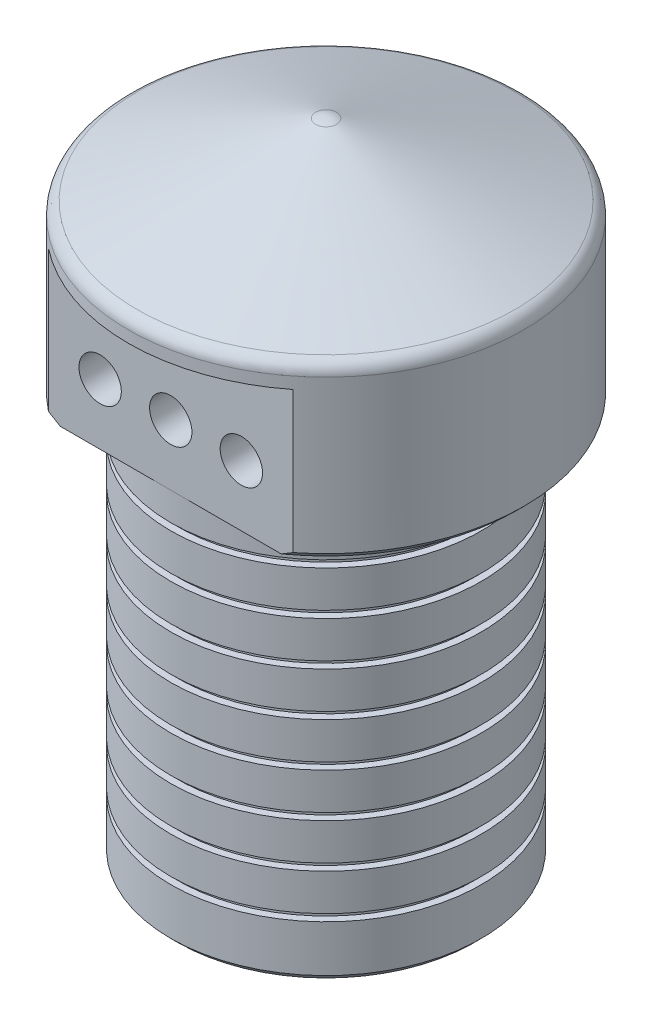
from build123d import *

# Parameters (mm, degrees)
SKETCH_1_R               = 11
EXTRUDE_1_DEPTH          = 28
SKETCH_2_R               = 14
EXTRUDE_2_DEPTH          = 12
FILLET_1_R               = 1
CHAMFER_1_SIZE           = 0.5
SKETCH_4_W               = 0.5
SKETCH_4_H               = 0.5
SKETCH_5_R               = 9
CUT_EXTRUDE_1_DEPTH      = 29
SKETCH_6_R               = 3
CUT_EXTRUDE_2_DEPTH      = 5
CUT_EXTRUDE_3_DEPTH      = 10.5
CUT_EXTRUDE_3_DEPTH_BACK = 2.2
CUT_EXTRUDE_3_START      = 28
SKETCH_7_W               = 42.252524986
SKETCH_7_H               = 12.607828389
SKETCH_8_R               = 1.5
CUT_EXTRUDE_4_DEPTH      = 10.5
SKETCH_8_3_R             = 1.5
CUT_EXTRUDE_5_DEPTH      = 54.724603976
CUT_EXTRUDE_START        = -7
SKETCH_9_R               = 2.75
CUT_EXTRUDE_6_DEPTH      = 10.5


with BuildPart() as part:
    # 草图1 → 凸台-拉伸1 (new body)
    with BuildSketch(Plane(origin=(0, 0, 0), x_dir=(1, 0, 0), z_dir=(0, 1, 0))):
        with Locations(Location((0, 0, 0), (0, 0, 270))):
            Circle(SKETCH_1_R)
    extrude(amount=EXTRUDE_1_DEPTH)

    # 草图2 → 凸台-拉伸2 (add)
    with BuildSketch(Plane(origin=(0, 28, 0), x_dir=(1, 0, 0), z_dir=(0, 1, 0))):
        with Locations(Location((0, 0, 0), (0, 0, 270))):
            Circle(SKETCH_2_R)
    extrude(amount=EXTRUDE_2_DEPTH)

    # 草图3 → 旋转1 (revolve)
    with BuildSketch(Plane.XY, mode=Mode.PRIVATE) as revolve_1_sk:
        with BuildLine():
            Line((-14, 40), (0, 40))
            Line((0, 40), (0, 45.445934077))
            ThreePointArc((0, 45.445934077), (-0.378215042, 45.409846851), (-0.742781353, 45.302887459))
            Line((-0.742781353, 45.302887459), (-14, 40))
        make_face()
    revolve(revolve_1_sk.sketch.rotate(Axis((0, 0, 0), (0, 1, 0)), 270), axis=Axis((0, 0, 0), (0, 1, 0)))

    # 圆角1
    fillet_1_edges = [part.edges().sort_by_distance(p)[0] for p in [
        (-14, 40, 0),
    ]]
    fillet(fillet_1_edges, radius=FILLET_1_R)

    # 倒角1
    chamfer_1_edges = [part.edges().sort_by_distance(p)[0] for p in [
        (0, 0, -11),
        (0, 28, -14),
    ]]
    chamfer(chamfer_1_edges, length=CHAMFER_1_SIZE)

    # 草图4 → 切除-旋转1 (revolve, cut)
    with BuildSketch(Plane(origin=(0, 0, 0), x_dir=(0, 0, -1), z_dir=(1, 0, 0)), mode=Mode.PRIVATE) as cut_revolve_1_sk:
        with Locations((-10.75, 25.75)):
            Rectangle(SKETCH_4_W, SKETCH_4_H)
        with Locations((-10.75, 22.65)):
            Rectangle(SKETCH_4_W, SKETCH_4_H)
        with Locations((-10.75, 19.55)):
            Rectangle(SKETCH_4_W, SKETCH_4_H)
        with Locations((-10.75, 16.45)):
            Rectangle(SKETCH_4_W, SKETCH_4_H)
        with Locations((-10.75, 13.35)):
            Rectangle(SKETCH_4_W, SKETCH_4_H)
        with Locations((-10.75, 10.25)):
            Rectangle(SKETCH_4_W, SKETCH_4_H)
        with Locations((-10.75, 7.15)):
            Rectangle(SKETCH_4_W, SKETCH_4_H)
        with Locations((-10.75, 4.05)):
            Rectangle(SKETCH_4_W, SKETCH_4_H)
    revolve(cut_revolve_1_sk.sketch.rotate(Axis((0, 0, 0), (0, 1, 0)), 180), axis=Axis((0, 0, 0), (0, 1, 0)), mode=Mode.SUBTRACT)

    # 草图5 → 切除-拉伸1 (cut)
    with BuildSketch(Plane.XZ):
        with Locations(Location((0, 0, 0), (0, 0, 270))):
            Circle(SKETCH_5_R)
    extrude(amount=-CUT_EXTRUDE_1_DEPTH, mode=Mode.SUBTRACT)

    # 草图6 → 切除-拉伸2 (cut)
    with BuildSketch(Plane.XZ.offset(-29)):
        with Locations(Location((0, 0, 0), (0, 0, 270))):
            Circle(SKETCH_6_R)
    extrude(amount=-CUT_EXTRUDE_2_DEPTH, mode=Mode.SUBTRACT)

    # 草图7 → 切除-拉伸3 (cut, two sides: drawn at the far end of the back side and taken through both)
    with BuildSketch(Plane(origin=(0, 0, 0), x_dir=(1, 0, 0), z_dir=(0, 1, 0)).offset(CUT_EXTRUDE_3_START - CUT_EXTRUDE_3_DEPTH_BACK)):
        with Locations((-1.165830539, -17.303914195)):
            Rectangle(SKETCH_7_W, SKETCH_7_H)
    extrude(amount=CUT_EXTRUDE_3_DEPTH + CUT_EXTRUDE_3_DEPTH_BACK, mode=Mode.SUBTRACT)

    # 草图8 → 切除-拉伸4 (cut)
    with BuildSketch(Plane.XY.offset(11)):
        with Locations((0, 32.3)):
            Circle(SKETCH_8_R)
    extrude(amount=-CUT_EXTRUDE_4_DEPTH, mode=Mode.SUBTRACT)

    # 草图8<3> → 切除-拉伸5 (cut, through all)
    with BuildSketch(Plane.XY.offset(11)):
        with Locations((-5, 32.3)):
            Circle(SKETCH_8_3_R)
        with Locations((5, 32.3)):
            Circle(SKETCH_8_3_R)
    extrude(amount=-CUT_EXTRUDE_5_DEPTH, mode=Mode.SUBTRACT)

    # 草图9 → 切除-拉伸6 (cut)
    with BuildSketch(Plane.XY.offset(CUT_EXTRUDE_START)):
        with Locations((5, 32.3)):
            Circle(SKETCH_9_R)
        with Locations((-5, 32.3)):
            Circle(SKETCH_9_R)
    extrude(amount=-CUT_EXTRUDE_6_DEPTH, mode=Mode.SUBTRACT)


solid = part.part
